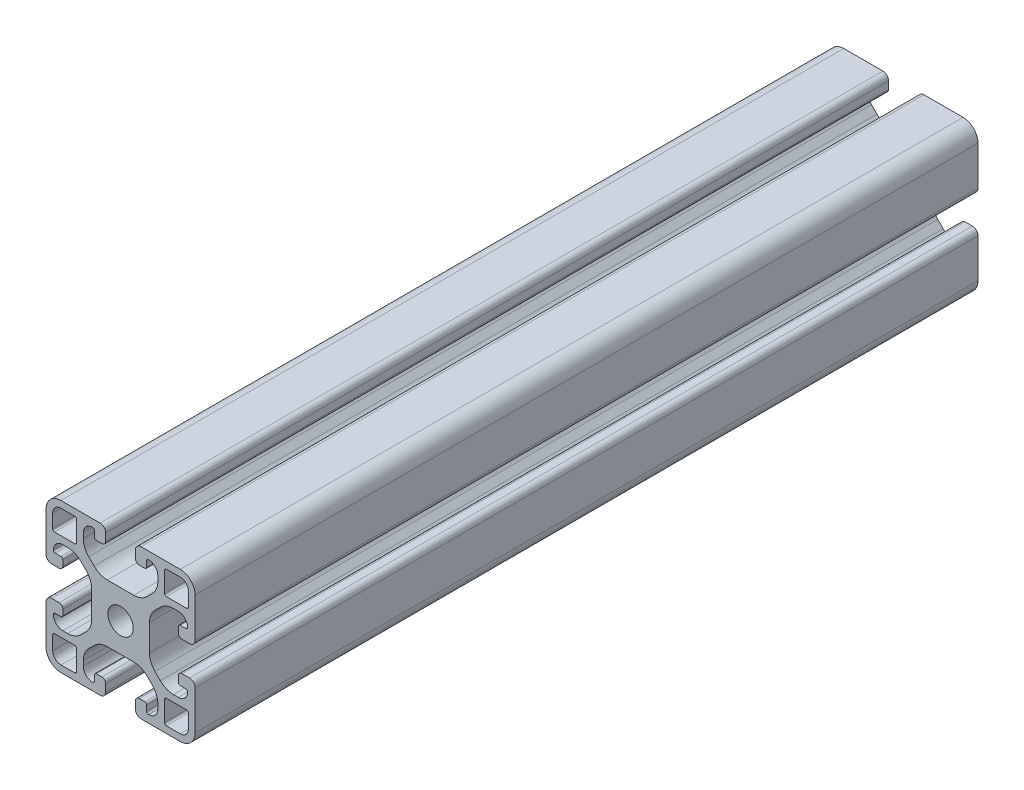
from build123d import *

# Parameters (mm, degrees)
ESQUISSE1_R        = 3.4
BOSS_EXTRU_1_DEPTH = 210


with BuildPart() as part:
    # Esquisse1 → Boss.-Extru.1 (new body)
    with BuildSketch(Plane(origin=(0, 0, -30), x_dir=(-1, 0, 0), z_dir=(0, 0, -1))):
        with BuildLine():
            Line((-4.5, 15), (-4.5, 13.5))
            ThreePointArc((-4.5, 13.5), (-4.353553391, 13.146446609), (-4, 13))
            Line((-4, 13), (-2.5, 13))
            ThreePointArc((-2.5, 13), (-2.146446609, 12.853553391), (-2, 12.5))
            ThreePointArc((-2, 12.5), (-2.732233047, 10.732233047), (-4.5, 10))
            Line((-4.5, 10), (-5.807611845, 10))
            ThreePointArc((-5.807611845, 10), (-7.721029006, 10.380602337), (-9.343145751, 11.464466094))
            Line((-9.343145751, 11.464466094), (-10.785533906, 12.906854249))
            ThreePointArc((-10.785533906, 12.906854249), (-11.869397663, 14.528970994), (-12.25, 16.442388155))
            Line((-12.25, 16.442388155), (-12.25, 23.557611845))
            ThreePointArc((-12.25, 23.557611845), (-11.869397663, 25.471029006), (-10.785533906, 27.093145751))
            Line((-10.785533906, 27.093145751), (-9.343145751, 28.535533906))
            ThreePointArc((-9.343145751, 28.535533906), (-7.721029006, 29.619397663), (-5.807611845, 30))
            Line((-5.807611845, 30), (-4.5, 30))
            ThreePointArc((-4.5, 30), (-2.732233047, 29.267766953), (-2, 27.5))
            ThreePointArc((-2, 27.5), (-2.146446609, 27.146446609), (-2.5, 27))
            Line((-2.5, 27), (-4, 27))
            ThreePointArc((-4, 27), (-4.353553391, 26.853553391), (-4.5, 26.5))
            Line((-4.5, 26.5), (-4.5, 25))
            ThreePointArc((-4.5, 25), (-4.207106781, 24.292893219), (-3.5, 24))
            Line((-3.5, 24), (-1.5, 24))
            ThreePointArc((-1.5, 24), (-0.439339828, 24.439339828), (0, 25.5))
            Line((0, 25.5), (0, 36))
            ThreePointArc((0, 36), (-1.171572875, 38.828427125), (-4, 40))
            Line((-4, 40), (-14.5, 40))
            ThreePointArc((-14.5, 40), (-15.560660172, 39.560660172), (-16, 38.5))
            Line((-16, 38.5), (-16, 36.5))
            ThreePointArc((-16, 36.5), (-15.707106781, 35.792893219), (-15, 35.5))
            Line((-15, 35.5), (-13.5, 35.5))
            ThreePointArc((-13.5, 35.5), (-13.146446609, 35.646446609), (-13, 36))
            Line((-13, 36), (-13, 37.5))
            ThreePointArc((-13, 37.5), (-12.853553391, 37.853553391), (-12.5, 38))
            ThreePointArc((-12.5, 38), (-10.732233047, 37.267766953), (-10, 35.5))
            Line((-10, 35.5), (-10, 34.192388155))
            ThreePointArc((-10, 34.192388155), (-10.380602337, 32.278970994), (-11.464466094, 30.656854249))
            Line((-11.464466094, 30.656854249), (-12.906854249, 29.214466094))
            ThreePointArc((-12.906854249, 29.214466094), (-14.528970994, 28.130602337), (-16.442388155, 27.75))
            Line((-16.442388155, 27.75), (-23.557611845, 27.75))
            ThreePointArc((-23.557611845, 27.75), (-25.471029006, 28.130602337), (-27.093145751, 29.214466094))
            Line((-27.093145751, 29.214466094), (-28.535533906, 30.656854249))
            ThreePointArc((-28.535533906, 30.656854249), (-29.619397663, 32.278970994), (-30, 34.192388155))
            Line((-30, 34.192388155), (-30, 35.5))
            ThreePointArc((-30, 35.5), (-29.267766953, 37.267766953), (-27.5, 38))
            ThreePointArc((-27.5, 38), (-27.146446609, 37.853553391), (-27, 37.5))
            Line((-27, 37.5), (-27, 36))
            ThreePointArc((-27, 36), (-26.853553391, 35.646446609), (-26.5, 35.5))
            Line((-26.5, 35.5), (-25, 35.5))
            ThreePointArc((-25, 35.5), (-24.292893219, 35.792893219), (-24, 36.5))
            Line((-24, 36.5), (-24, 38.5))
            ThreePointArc((-24, 38.5), (-24.439339828, 39.560660172), (-25.5, 40))
            Line((-25.5, 40), (-36, 40))
            ThreePointArc((-36, 40), (-38.828427125, 38.828427125), (-40, 36))
            Line((-40, 36), (-40, 25.5))
            ThreePointArc((-40, 25.5), (-39.560660172, 24.439339828), (-38.5, 24))
            Line((-38.5, 24), (-36.5, 24))
            ThreePointArc((-36.5, 24), (-35.792893219, 24.292893219), (-35.5, 25))
            Line((-35.5, 25), (-35.5, 26.5))
            ThreePointArc((-35.5, 26.5), (-35.646446609, 26.853553391), (-36, 27))
            Line((-36, 27), (-37.5, 27))
            ThreePointArc((-37.5, 27), (-37.853553391, 27.146446609), (-38, 27.5))
            ThreePointArc((-38, 27.5), (-37.267766953, 29.267766953), (-35.5, 30))
            Line((-35.5, 30), (-34.192388155, 30))
            ThreePointArc((-34.192388155, 30), (-32.278970994, 29.619397663), (-30.656854249, 28.535533906))
            Line((-30.656854249, 28.535533906), (-29.214466094, 27.093145751))
            ThreePointArc((-29.214466094, 27.093145751), (-28.130602337, 25.471029006), (-27.75, 23.557611845))
            Line((-27.75, 23.557611845), (-27.75, 16.442388155))
            ThreePointArc((-27.75, 16.442388155), (-28.130602337, 14.528970994), (-29.214466094, 12.906854249))
            Line((-29.214466094, 12.906854249), (-30.656854249, 11.464466094))
            ThreePointArc((-30.656854249, 11.464466094), (-32.278970994, 10.380602337), (-34.192388155, 10))
            Line((-34.192388155, 10), (-35.5, 10))
            ThreePointArc((-35.5, 10), (-37.267766953, 10.732233047), (-38, 12.5))
            ThreePointArc((-38, 12.5), (-37.853553391, 12.853553391), (-37.5, 13))
            Line((-37.5, 13), (-36, 13))
            ThreePointArc((-36, 13), (-35.646446609, 13.146446609), (-35.5, 13.5))
            Line((-35.5, 13.5), (-35.5, 15))
            ThreePointArc((-35.5, 15), (-35.792893219, 15.707106781), (-36.5, 16))
            Line((-36.5, 16), (-38.5, 16))
            ThreePointArc((-38.5, 16), (-39.560660172, 15.560660172), (-40, 14.5))
            Line((-40, 14.5), (-40, 4))
            ThreePointArc((-40, 4), (-38.828427125, 1.171572875), (-36, 0))
            Line((-36, 0), (-25.5, 0))
            ThreePointArc((-25.5, 0), (-24.439339828, 0.439339828), (-24, 1.5))
            Line((-24, 1.5), (-24, 3.5))
            ThreePointArc((-24, 3.5), (-24.292893219, 4.207106781), (-25, 4.5))
            Line((-25, 4.5), (-26.5, 4.5))
            ThreePointArc((-26.5, 4.5), (-26.853553391, 4.353553391), (-27, 4))
            Line((-27, 4), (-27, 2.5))
            ThreePointArc((-27, 2.5), (-27.146446609, 2.146446609), (-27.5, 2))
            ThreePointArc((-27.5, 2), (-29.267766953, 2.732233047), (-30, 4.5))
            Line((-30, 4.5), (-30, 5.807611845))
            ThreePointArc((-30, 5.807611845), (-29.619397663, 7.721029006), (-28.535533906, 9.343145751))
            Line((-28.535533906, 9.343145751), (-27.093145751, 10.785533906))
            ThreePointArc((-27.093145751, 10.785533906), (-25.471029006, 11.869397663), (-23.557611845, 12.25))
            Line((-23.557611845, 12.25), (-16.442388155, 12.25))
            ThreePointArc((-16.442388155, 12.25), (-14.528970994, 11.869397663), (-12.906854249, 10.785533906))
            Line((-12.906854249, 10.785533906), (-11.464466094, 9.343145751))
            ThreePointArc((-11.464466094, 9.343145751), (-10.380602337, 7.721029006), (-10, 5.807611845))
            Line((-10, 5.807611845), (-10, 4.5))
            ThreePointArc((-10, 4.5), (-10.732233047, 2.732233047), (-12.5, 2))
            ThreePointArc((-12.5, 2), (-12.853553391, 2.146446609), (-13, 2.5))
            Line((-13, 2.5), (-13, 4))
            ThreePointArc((-13, 4), (-13.146446609, 4.353553391), (-13.5, 4.5))
            Line((-13.5, 4.5), (-15, 4.5))
            ThreePointArc((-15, 4.5), (-15.707106781, 4.207106781), (-16, 3.5))
            Line((-16, 3.5), (-16, 1.5))
            ThreePointArc((-16, 1.5), (-15.560660172, 0.439339828), (-14.5, 0))
            Line((-14.5, 0), (-4, 0))
            ThreePointArc((-4, 0), (-1.171572875, 1.171572875), (0, 4))
            Line((0, 4), (0, 14.5))
            ThreePointArc((0, 14.5), (-0.439339828, 15.560660172), (-1.5, 16))
            Line((-1.5, 16), (-3.5, 16))
            ThreePointArc((-3.5, 16), (-4.207106781, 15.707106781), (-4.5, 15))
        make_face()
        with Locations(Location((-20, 20, 0), (0, 0, 180))):
            Circle(ESQUISSE1_R, mode=Mode.SUBTRACT)
        with BuildLine():
            Line((-4, 1.8), (-7.7, 1.8))
            ThreePointArc((-7.7, 1.8), (-8.053553391, 1.946446609), (-8.2, 2.3))
            Line((-8.2, 2.3), (-8.2, 7.7))
            ThreePointArc((-8.2, 7.7), (-8.053553391, 8.053553391), (-7.7, 8.2))
            Line((-7.7, 8.2), (-2.3, 8.2))
            ThreePointArc((-2.3, 8.2), (-1.946446609, 8.053553391), (-1.8, 7.7))
            Line((-1.8, 7.7), (-1.8, 4))
            ThreePointArc((-1.8, 4), (-2.444365081, 2.444365081), (-4, 1.8))
        make_face(mode=Mode.SUBTRACT)
        with BuildLine():
            Line((-38.2, 4), (-38.2, 7.7))
            ThreePointArc((-38.2, 7.7), (-38.053553391, 8.053553391), (-37.7, 8.2))
            Line((-37.7, 8.2), (-32.3, 8.2))
            ThreePointArc((-32.3, 8.2), (-31.946446609, 8.053553391), (-31.8, 7.7))
            Line((-31.8, 7.7), (-31.8, 2.3))
            ThreePointArc((-31.8, 2.3), (-31.946446609, 1.946446609), (-32.3, 1.8))
            Line((-32.3, 1.8), (-36, 1.8))
            ThreePointArc((-36, 1.8), (-37.555634919, 2.444365081), (-38.2, 4))
        make_face(mode=Mode.SUBTRACT)
        with BuildLine():
            Line((-36, 38.2), (-32.3, 38.2))
            ThreePointArc((-32.3, 38.2), (-31.946446609, 38.053553391), (-31.8, 37.7))
            Line((-31.8, 37.7), (-31.8, 32.3))
            ThreePointArc((-31.8, 32.3), (-31.946446609, 31.946446609), (-32.3, 31.8))
            Line((-32.3, 31.8), (-37.7, 31.8))
            ThreePointArc((-37.7, 31.8), (-38.053553391, 31.946446609), (-38.2, 32.3))
            Line((-38.2, 32.3), (-38.2, 36))
            ThreePointArc((-38.2, 36), (-37.555634919, 37.555634919), (-36, 38.2))
        make_face(mode=Mode.SUBTRACT)
        with BuildLine():
            Line((-1.8, 36), (-1.8, 32.3))
            ThreePointArc((-1.8, 32.3), (-1.946446609, 31.946446609), (-2.3, 31.8))
            Line((-2.3, 31.8), (-7.7, 31.8))
            ThreePointArc((-7.7, 31.8), (-8.053553391, 31.946446609), (-8.2, 32.3))
            Line((-8.2, 32.3), (-8.2, 37.7))
            ThreePointArc((-8.2, 37.7), (-8.053553391, 38.053553391), (-7.7, 38.2))
            Line((-7.7, 38.2), (-4, 38.2))
            ThreePointArc((-4, 38.2), (-2.444365081, 37.555634919), (-1.8, 36))
        make_face(mode=Mode.SUBTRACT)
    extrude(amount=-BOSS_EXTRU_1_DEPTH)


solid = part.part
